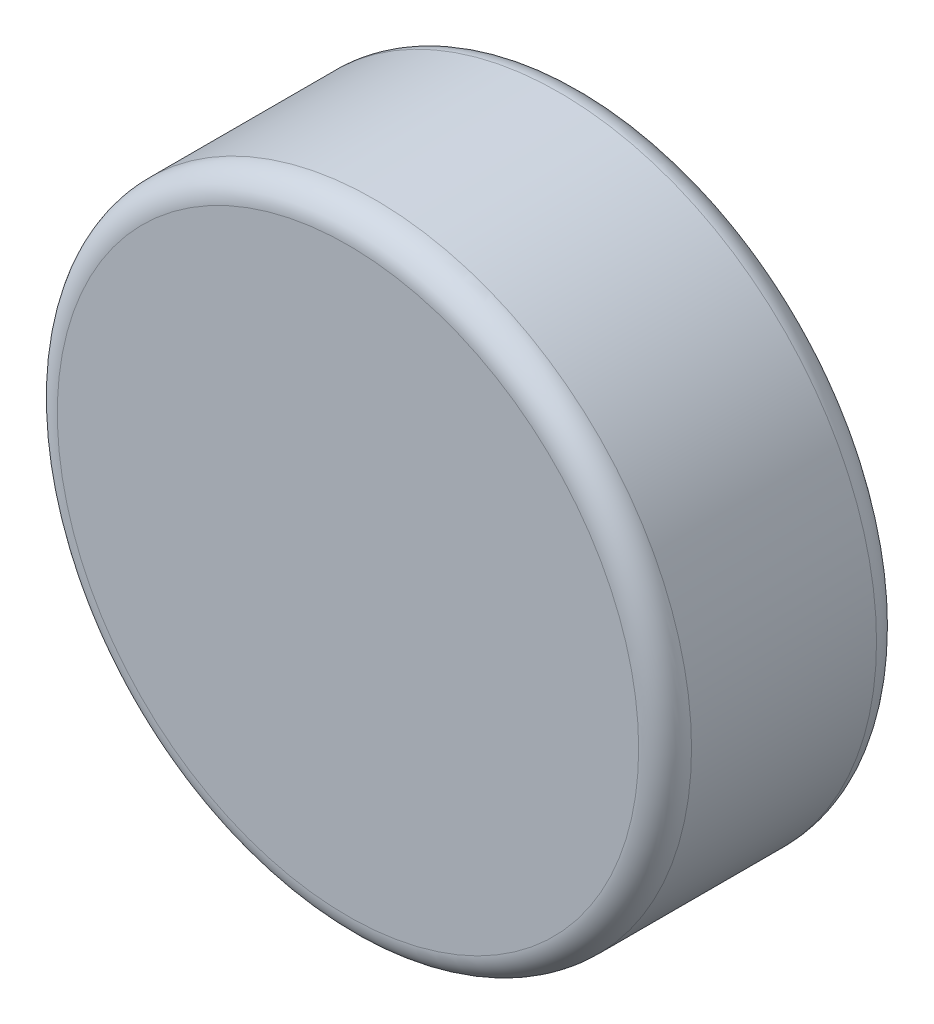
from build123d import *

# Parameters (mm, degrees)
SKETCH1_R           = 30.48
BOSS_EXTRUDE2_DEPTH = 22.86
FILLET1_R           = 2.54
FILLET2_R           = 2.54


with BuildPart() as part:
    # Sketch1 → Boss-Extrude2 (new body)
    with BuildSketch(Plane.XY):
        Circle(SKETCH1_R)
    extrude(amount=BOSS_EXTRUDE2_DEPTH)

    # Fillet1
    fillet1_edges = [part.edges().sort_by_distance(p)[0] for p in [
        (-30.48, 0, 22.86),
    ]]
    fillet(fillet1_edges, radius=FILLET1_R)

    # Fillet2
    fillet2_edges = [part.edges().sort_by_distance(p)[0] for p in [
        (-30.48, 0, 0),
    ]]
    fillet(fillet2_edges, radius=FILLET2_R)


solid = part.part
